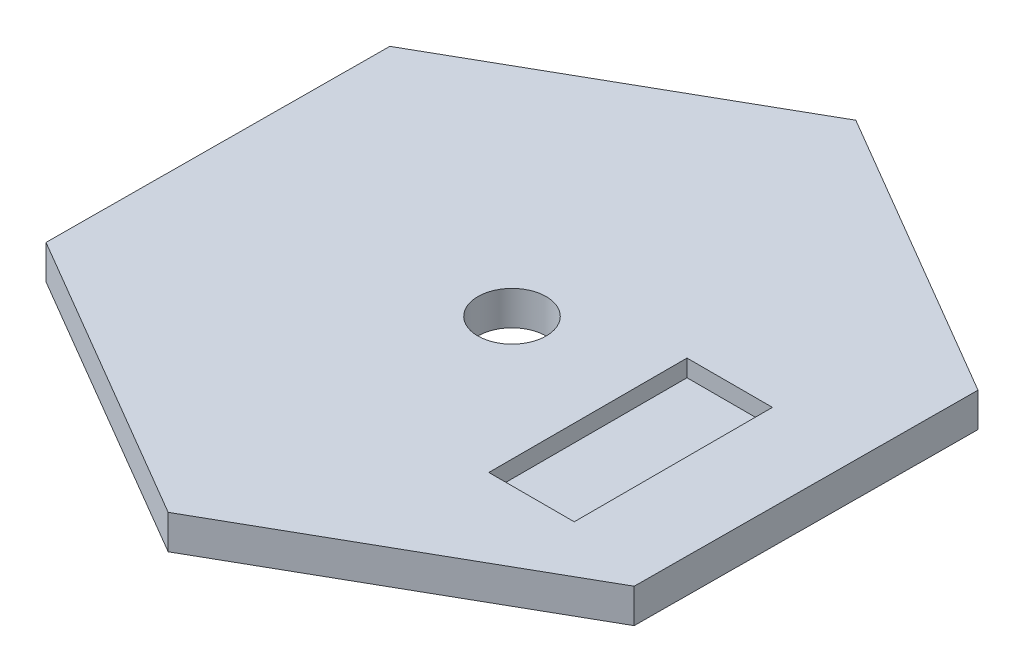
from build123d import *

# Parameters (mm, degrees)
SALIENTE_EXTRUIR1_DEPTH = 10
CROQUIS2_R              = 10
CORTAR_EXTRUIR1_DEPTH   = 10
CROQUIS3_W              = 25
CROQUIS3_H              = 58
CORTAR_EXTRUIR2_DEPTH   = 5


with BuildPart() as part:
    # Croquis1 → Saliente-Extruir1 (new body)
    with BuildSketch(Plane(origin=(0, 0, 0), x_dir=(1, 0, 0), z_dir=(0, 1, 0))):
        Polygon((-86.291306126, 50.535240052), (-86.910454734, -49.462843205), (-0.619148608, -99.998083257), (86.291306126, -50.535240052), (86.910454734, 49.462843205), (0.619148608, 99.998083257), align=None)
    extrude(amount=SALIENTE_EXTRUIR1_DEPTH)

    # Croquis2 → Cortar-Extruir1 (cut)
    with BuildSketch(Plane(origin=(0, 10, 0), x_dir=(1, 0, 0), z_dir=(0, 1, 0))):
        with Locations(Location((0, 0, 0), (0, 0, 270))):
            Circle(CROQUIS2_R)
    extrude(amount=-CORTAR_EXTRUIR1_DEPTH, mode=Mode.SUBTRACT)

    # Croquis3 → Cortar-Extruir2 (cut)
    with BuildSketch(Plane(origin=(0, 10, 0), x_dir=(1, 0, 0), z_dir=(0, 1, 0))):
        with Locations((48.693290604, -13.979093197)):
            Rectangle(CROQUIS3_W, CROQUIS3_H)
    extrude(amount=-CORTAR_EXTRUIR2_DEPTH, mode=Mode.SUBTRACT)


solid = part.part
